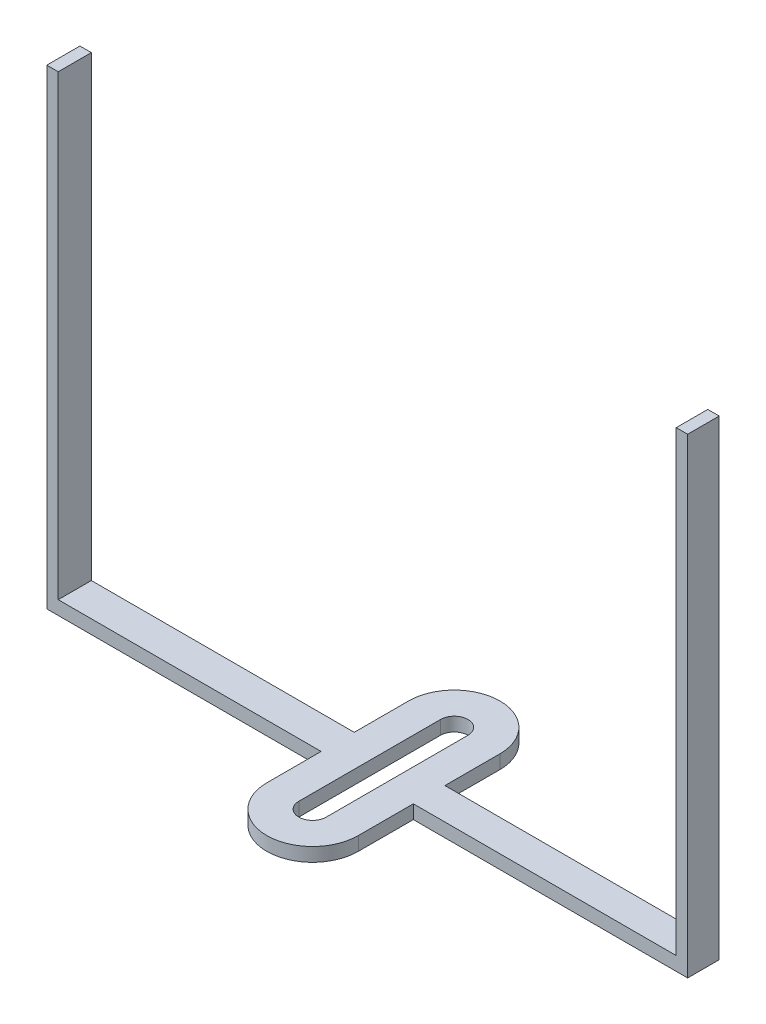
from build123d import *

# Parameters (mm, degrees)
BOSS_EXTRUDE1_DEPTH = 3
SKETCH2_W           = 6.903287468
SKETCH2_H           = 3
BOSS_EXTRUDE2_DEPTH = 60
SKETCH3_W           = 7.25
SKETCH3_H           = 3
BOSS_EXTRUDE3_DEPTH = 60
SKETCH4_W           = 2.5
SKETCH4_H           = 6.903287468
SKETCH4_H_2         = 7.25
BOSS_EXTRUDE4_DEPTH = 100


with BuildPart() as part:
    # Sketch1 → Boss-Extrude1 (new body)
    with BuildSketch(Plane(origin=(0, 0, 0), x_dir=(1, 0, 0), z_dir=(0, 1, 0))):
        with BuildLine():
            Line((10, 31), (10, 0))
            ThreePointArc((10, 0), (0, -10), (-10, 0))
            Line((-10, 0), (-10, 31))
            ThreePointArc((-10, 31), (0, 41), (10, 31))
        make_face()
        with BuildLine():
            Line((-3, 0), (-3, 31))
            ThreePointArc((-3, 31), (0, 34), (3, 31))
            Line((3, 31), (3, 0))
            ThreePointArc((3, 0), (0, -3), (-3, 0))
        make_face(mode=Mode.SUBTRACT)
    extrude(amount=BOSS_EXTRUDE1_DEPTH)

    # Sketch2 → Boss-Extrude2 (add)
    with BuildSketch(Plane(origin=(10, 0, 0), x_dir=(0, 0, -1), z_dir=(1, 0, 0))):
        with Locations((15.5, 1.5)):
            Rectangle(SKETCH2_W, SKETCH2_H)
    extrude(amount=BOSS_EXTRUDE2_DEPTH)

    # Sketch3 → Boss-Extrude3 (add)
    with BuildSketch(Plane.ZY.offset(10)):
        with Locations((-15.5, 1.5)):
            Rectangle(SKETCH3_W, SKETCH3_H)
    extrude(amount=BOSS_EXTRUDE3_DEPTH)

    # Sketch4 → Boss-Extrude4 (add)
    with BuildSketch(Plane(origin=(0, 3, 0), x_dir=(1, 0, 0), z_dir=(0, 1, 0))):
        with Locations((68.75, 15.5)):
            Rectangle(SKETCH4_W, SKETCH4_H)
        with Locations((-68.75, 15.5)):
            Rectangle(SKETCH4_W, SKETCH4_H_2)
    extrude(amount=BOSS_EXTRUDE4_DEPTH)


solid = part.part
